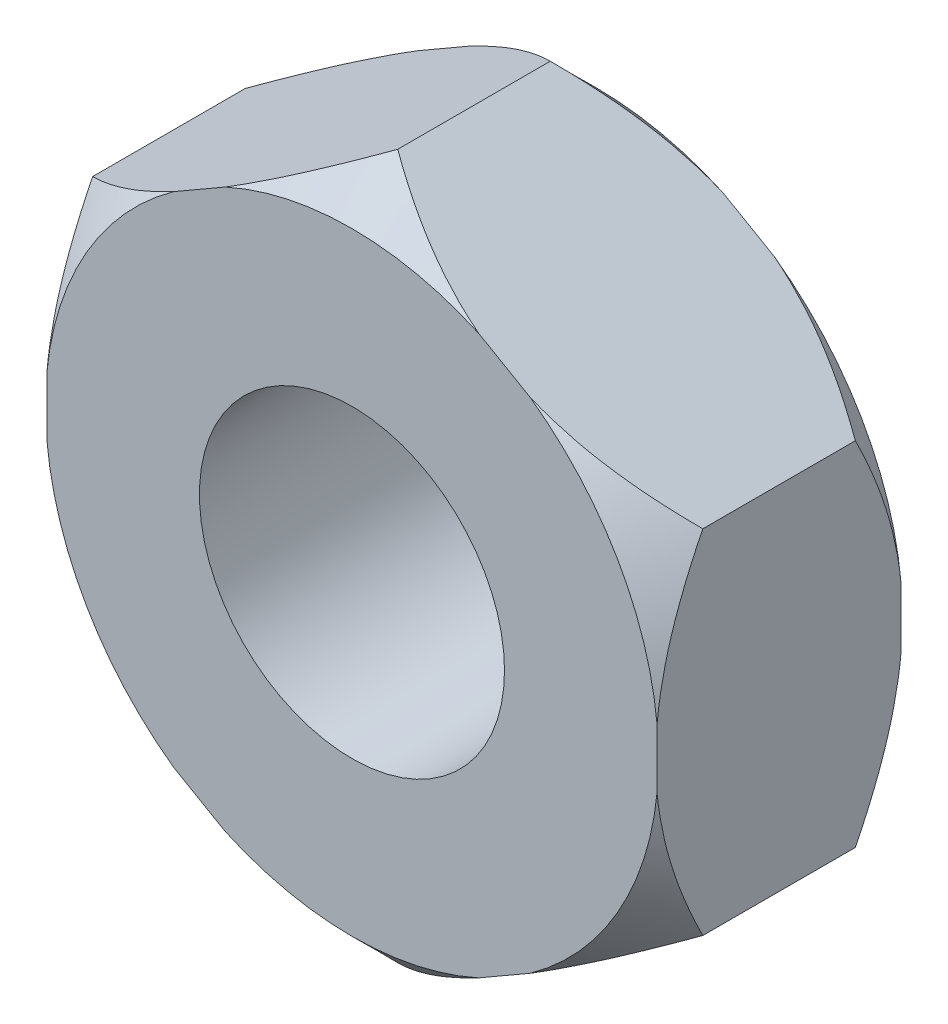
from build123d import *

# Parameters (mm, degrees)
EXTRUDE_1_DEPTH     = 1.6
SKETCH_6_R          = 1
CUT_EXTRUDE_1_DEPTH = 1.6


with BuildPart() as part:
    # 草图3 → 凸台-拉伸1 (new body)
    with BuildSketch(Plane.XY):
        Polygon((2, 1.154700538), (0, 2.309401077), (-2, 1.154700538), (-2, -1.154700538), (0, -2.309401077), (2, -1.154700538), align=None)
    extrude(amount=EXTRUDE_1_DEPTH)

    # 草图5 → 切除-旋转1 (revolve, cut)
    with BuildSketch(Plane(origin=(0, 0, 0), x_dir=(0, 0, -1), z_dir=(1, 0, 0))):
        Polygon((-1.3, 2.309401077), (-1.6, 2.309401077), (-1.6, 2.009401077), align=None)
        Polygon((0, 2.009401077), (-0.3, 2.309401077), (0, 2.309401077), align=None)
    revolve(axis=Axis((0, 0, 0), (0, 0, 1)), mode=Mode.SUBTRACT)

    # 草图6 → 切除-拉伸1 (cut)
    with BuildSketch(Plane.XY.offset(1.6)):
        Circle(SKETCH_6_R)
    extrude(amount=-CUT_EXTRUDE_1_DEPTH, mode=Mode.SUBTRACT)


solid = part.part
